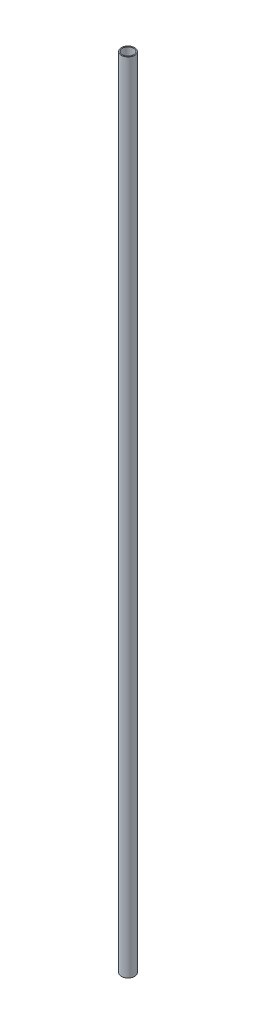
from build123d import *

# Parameters (mm, degrees)
SKETCH1_R           = 6.45
SKETCH1_R_2         = 5.45
BOSS_EXTRUDE1_DEPTH = 770


with BuildPart() as part:
    # Sketch1 → Boss-Extrude1 (new body)
    with BuildSketch(Plane(origin=(0, 0, 0), x_dir=(1, 0, 0), z_dir=(0, 1, 0))):
        with Locations(Location((0, 0, 0), (0, 0, 270))):
            Circle(SKETCH1_R)
        with Locations(Location((0, 0, 0), (0, 0, 270))):
            Circle(SKETCH1_R_2, mode=Mode.SUBTRACT)
    extrude(amount=BOSS_EXTRUDE1_DEPTH)


solid = part.part
